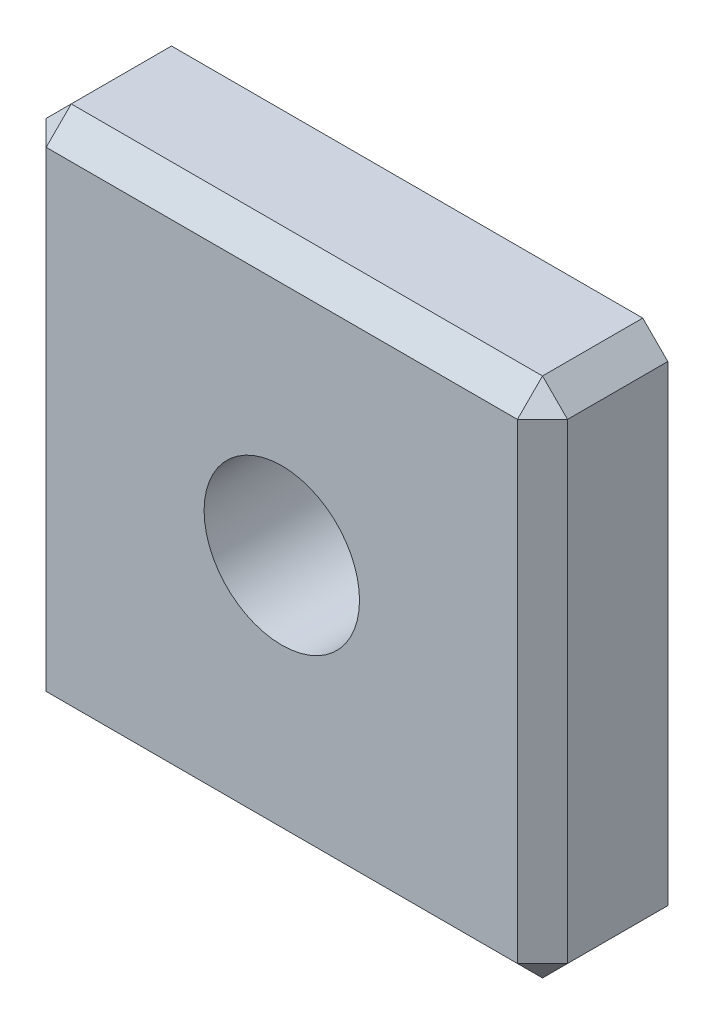
from build123d import *

# Parameters (mm, degrees)
ESQUISSE2_W                  = 20.8
ESQUISSE2_H                  = 20.8
BOSS_EXTRU_1_DEPTH           = 5
ENL_V_MAT_EXTRU_1_DEPTH      = 30.837560222
ENL_V_MAT_EXTRU_1_DEPTH_BACK = 30.837560222
ESQUISSE4_R                  = 3.1
CHANFREIN1_SIZE              = 1


with BuildPart() as part:
    # Esquisse2 → Boss.-Extru.1 (new body)
    with BuildSketch(Plane.XY):
        with Locations((10.4, 10.4)):
            Rectangle(ESQUISSE2_W, ESQUISSE2_H)
    extrude(amount=BOSS_EXTRU_1_DEPTH)

    # Esquisse4 → Enlèv. mat.-Extru.1 (cut, two sides: drawn at the far end of the back side and taken through both)
    with BuildSketch(Plane.XY.offset(5).offset(-ENL_V_MAT_EXTRU_1_DEPTH_BACK)):
        with Locations((10.4, 10.4)):
            Circle(ESQUISSE4_R)
    extrude(amount=ENL_V_MAT_EXTRU_1_DEPTH + ENL_V_MAT_EXTRU_1_DEPTH_BACK, mode=Mode.SUBTRACT)

    # Chanfrein1
    chanfrein1_edges = [part.edges().sort_by_distance(p)[0] for p in [
        (20.8, 10.4, 5),
        (10.4, 20.8, 5),
        (0, 10.4, 5),
        (0, 20.8, 2.5),
        (20.8, 20.8, 2.5),
        (20.8, 0, 2.5),
        (0, 0, 2.5),
        (10.4, 0, 5),
    ]]
    chamfer(chanfrein1_edges, length=CHANFREIN1_SIZE)


solid = part.part
